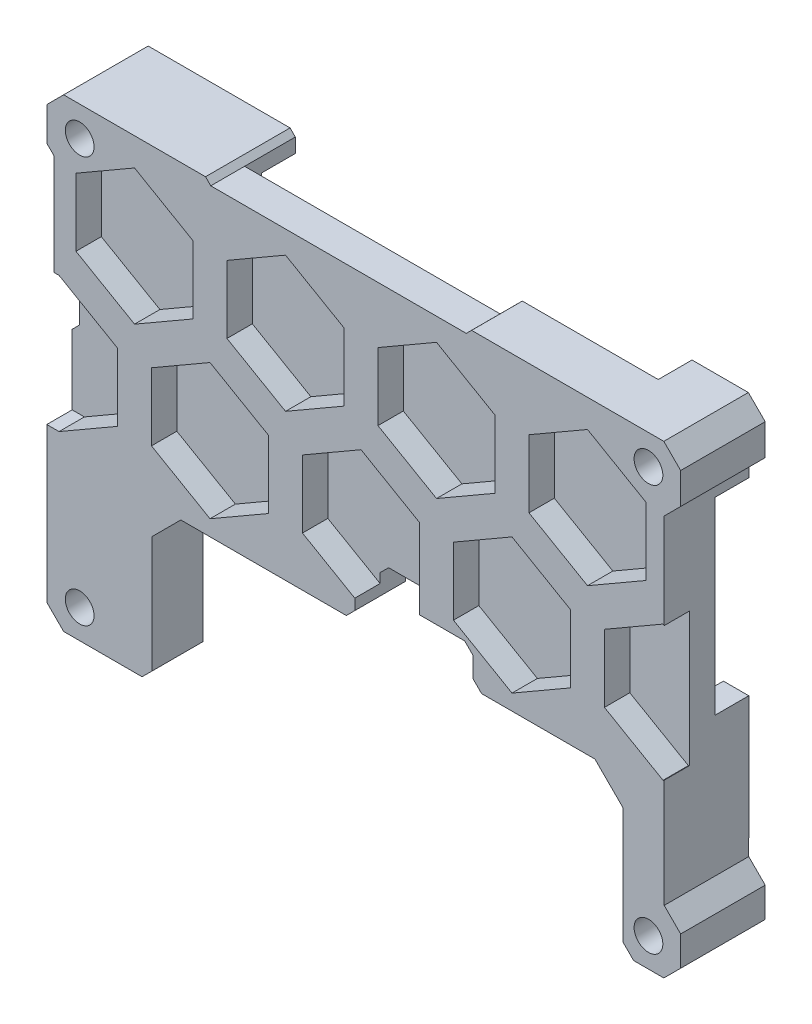
from build123d import *

# Parameters (mm, degrees)
SKETCH_1_W           = 85
SKETCH_1_H           = 65
EXTRUDE_1_DEPTH      = 10
CUT_EXTRUDE_1_REACH  = 109.471
SKETCH_2_R           = 1.7
CUT_EXTRUDE_2_REACH  = 109.471
SKETCH_3_W           = 85
SKETCH_3_H           = 65
CUT_EXTRUDE_4_REACH  = 102.464
CUT_EXTRUDE_7_DEPTH  = 6
CUT_EXTRUDE_8_DEPTH  = 6
CUT_EXTRUDE_11_DEPTH = 4
SKETCH_8_W           = 8
SKETCH_8_H           = 5
CUT_EXTRUDE_12_DEPTH = 1
SKETCH_10_W          = 5.4
SKETCH_10_H          = 6
SKETCH_10_W_2        = 4
EXTRUDE_2_DEPTH      = 3.04
SKETCH_11_W          = 4.2
SKETCH_11_H          = 5
EXTRUDE_3_DEPTH      = 2.300115
SKETCH_12_W          = 12
SKETCH_12_H          = 6
EXTRUDE_4_DEPTH      = 2.89
SKETCH_13_W          = 6.499986347
SKETCH_13_H          = 5.115524378
EXTRUDE_5_DEPTH      = 3.6
SKETCH_14_W          = 6
SKETCH_14_H          = 7
EXTRUDE_6_DEPTH      = 2.890002
SKETCH_15_W          = 14
SKETCH_15_H          = 4.4
CUT_EXTRUDE_13_DEPTH = 6
CHAMFER_1_SIZE       = 1
CHAMFER_2_SIZE       = 0.6
CHAMFER_3_SIZE       = 0.6
CHAMFER_4_SIZE       = 0.6
CHAMFER_5_SIZE       = 0.6
CHAMFER_6_SIZE       = 0.6
CUT_EXTRUDE_15_DEPTH = 3
CUT_EXTRUDE_16_DEPTH = 3


with BuildPart() as part:
    # 草图1 → 凸台-拉伸1 (new body)
    with BuildSketch(Plane.XY):
        with Locations((42.5, 32.5)):
            Rectangle(SKETCH_1_W, SKETCH_1_H)
    extrude(amount=EXTRUDE_1_DEPTH)

    # 草图2 → 切除-拉伸1 (cut, up to next)
    with BuildSketch(Plane(origin=(0, 0, 0), x_dir=(-1, 0, 0), z_dir=(0, 0, -1)), mode=Mode.PRIVATE) as cut_extrude_1_sk1:
        with Locations((-76.166921514, 56.442524765)):
            Circle(SKETCH_2_R)
    cut_extrude_1_tool1 = extrude(cut_extrude_1_sk1.sketch, amount=-CUT_EXTRUDE_1_REACH, mode=Mode.PRIVATE) & part.part
    # 草图2 → 切除-拉伸1 (cut, up to next)
    with BuildSketch(Plane(origin=(0, 0, 0), x_dir=(-1, 0, 0), z_dir=(0, 0, -1)), mode=Mode.PRIVATE) as cut_extrude_1_sk2:
        with Locations((-8.888803658, 56.442524765)):
            Circle(SKETCH_2_R)
    cut_extrude_1_tool2 = extrude(cut_extrude_1_sk2.sketch, amount=-CUT_EXTRUDE_1_REACH, mode=Mode.PRIVATE) & part.part
    # 草图2 → 切除-拉伸1 (cut, up to next)
    with BuildSketch(Plane(origin=(0, 0, 0), x_dir=(-1, 0, 0), z_dir=(0, 0, -1)), mode=Mode.PRIVATE) as cut_extrude_1_sk3:
        with Locations((-76.166921514, 8.41508509)):
            Circle(SKETCH_2_R)
    cut_extrude_1_tool3 = extrude(cut_extrude_1_sk3.sketch, amount=-CUT_EXTRUDE_1_REACH, mode=Mode.PRIVATE) & part.part
    # 草图2 → 切除-拉伸1 (cut, up to next)
    with BuildSketch(Plane(origin=(0, 0, 0), x_dir=(-1, 0, 0), z_dir=(0, 0, -1)), mode=Mode.PRIVATE) as cut_extrude_1_sk4:
        with Locations((-8.888803658, 8.41508509)):
            Circle(SKETCH_2_R)
    cut_extrude_1_tool4 = extrude(cut_extrude_1_sk4.sketch, amount=-CUT_EXTRUDE_1_REACH, mode=Mode.PRIVATE) & part.part
    add(cut_extrude_1_tool1.solids().sort_by_distance((76.166922, 56.442525, 0))[0], mode=Mode.SUBTRACT)
    add(cut_extrude_1_tool2.solids().sort_by_distance((8.888804, 56.442525, 0))[0], mode=Mode.SUBTRACT)
    add(cut_extrude_1_tool3.solids().sort_by_distance((76.166922, 8.415085, 0))[0], mode=Mode.SUBTRACT)
    add(cut_extrude_1_tool4.solids().sort_by_distance((8.888804, 8.415085, 0))[0], mode=Mode.SUBTRACT)

    # 草图3 → 切除-拉伸2 (cut, up to next)
    with BuildSketch(Plane(origin=(0, 0, 0), x_dir=(-1, 0, 0), z_dir=(0, 0, -1)), mode=Mode.PRIVATE) as cut_extrude_2_sk1:
        with Locations((-42.5, 32.5)):
            Rectangle(SKETCH_3_W, SKETCH_3_H)
        Polygon((-5, 33.462892894), (-5.871324699, 34.334217592), (-5.87504445, 53.137061214), (-5, 54.017366187), (-5, 57.982143592), (-6.992565577, 59.974709169), (-23.773560915, 59.974709169), (-24.394872914, 59.353397171), (-54.61482093, 59.349677419), (-55.245113202, 59.974709169), (-77.982184232, 59.974709169), (-79.974749809, 57.982143592), (-79.97474981, 54.295829484), (-78.032030648, 52.353110322), (-78.028310897, 12.45999492), (-79.97474981, 10.508295484), (-79.97474981, 6.992565577), (-77.982184232, 5), (-74.414239441, 5), (-73.152434681, 6.26180476), (-60.043505207, 6.265524511), (-58.772720173, 5), (-32.926479725, 5), (-31.743585303, 6.182894422), (-17.461559563, 6.186614173), (-16.269684867, 5), (-6.992565577, 5), (-5, 6.992565577), align=None, mode=Mode.SUBTRACT)
    cut_extrude_2_tool1 = extrude(cut_extrude_2_sk1.sketch, amount=-CUT_EXTRUDE_2_REACH, mode=Mode.PRIVATE) & part.part
    add(cut_extrude_2_tool1.solids().sort_by_distance((42.5, 63.929953, 0))[0], mode=Mode.SUBTRACT)

    # 草图4 → 切除-拉伸4 (cut, up to next)
    with BuildSketch(Plane(origin=(0, 0, 0), x_dir=(-1, 0, 0), z_dir=(0, 0, -1)), mode=Mode.PRIVATE) as cut_extrude_4_sk1:
        Polygon((-73.152434681, 6.26180476), (-73.152434681, 20.032317315), (-69.831576581, 23.353175415), (-46.787984184, 23.353175415), (-20.851296271, 23.353175415), (-17.461559563, 19.963438707), (-17.461559563, 6.186614173), (-17.461559563, 0.193960815), (-73.152434681, 0.193960815), align=None)
    cut_extrude_4_tool1 = extrude(cut_extrude_4_sk1.sketch, amount=-CUT_EXTRUDE_4_REACH, mode=Mode.PRIVATE) & part.part
    add(cut_extrude_4_tool1.solids().sort_by_distance((45.311727, 11.681443, 0))[0], mode=Mode.SUBTRACT)

    # 草图5 → 切除-拉伸7 (cut)
    with BuildSketch(Plane(origin=(0, 0, 0), x_dir=(-1, 0, 0), z_dir=(0, 0, -1))):
        Polygon((-24.394872914, 59.353397171), (-24.394872914, 53.906418167), (-25.526104495, 52.774908066), (-53.482640788, 52.774908066), (-54.614150889, 53.906139647), (-54.61482093, 59.349677419), align=None)
    extrude(amount=-CUT_EXTRUDE_7_DEPTH, mode=Mode.SUBTRACT)

    # 草图6 → 切除-拉伸8 (cut)
    with BuildSketch(Plane(origin=(0, 0, 0), x_dir=(-1, 0, 0), z_dir=(0, 0, -1))):
        Polygon((-5.871324699, 34.334217592), (-11.136213102, 34.334217592), (-11.687697798, 35.836171197), (-11.687697798, 43.836171197), (-10.273484235, 45.250384759), (-5.873484235, 45.250384759), align=None)
    extrude(amount=-CUT_EXTRUDE_8_DEPTH, mode=Mode.SUBTRACT)

    # 草图7 → 切除-拉伸11 (cut)
    with BuildSketch(Plane(origin=(0, 0, 0), x_dir=(-1, 0, 0), z_dir=(0, 0, -1))):
        Polygon((-74.432117646, 51.26230094), (-76.432117646, 51.26230094), (-78.031928938, 51.26230094), (-78.029847328, 28.93771831), (-75.029847328, 28.93771831), (-75.029847328, 13.93771831), (-73.152434681, 12.060305663), (-73.152434681, 20.032317315), (-69.831576581, 23.353175415), (-20.851296271, 23.353175415), (-17.461559563, 19.963438707), (-17.461559563, 6.186614173), (-16.269684867, 5), (-12.014024847, 5), (-12.014024847, 10.599811284), (-10.599811284, 12.014024847), (-6.599811284, 12.014024847), (-5, 12.014024847), (-5, 33.462892894), (-5.871324699, 34.334217592), (-11.136213102, 34.334217592), (-11.687697798, 35.836171197), (-11.687697798, 43.836171197), (-10.273484235, 45.250384759), (-5.873484235, 45.250384759), (-5.87504445, 53.137061214), (-9.87504445, 53.137061214), (-12.071959353, 55.333976117), (-12.071959353, 58.333976117), (-23.061659554, 58.333976117), (-23.732127818, 57.663342778), (-24.394872914, 57.663261201), (-24.394872914, 53.906418167), (-25.526104495, 52.774908066), (-53.482640788, 52.774908066), (-54.614150889, 53.906139647), (-54.61482093, 59.349677419), (-55.245113202, 59.974709169), (-71.319520701, 59.974709169), (-71.319520701, 58.374897885), (-71.319520701, 54.374897885), align=None)
    extrude(amount=-CUT_EXTRUDE_11_DEPTH, mode=Mode.SUBTRACT)

    # 草图8 → 切除-拉伸12 (cut)
    with BuildSketch(Plane(origin=(0, 0, 4), x_dir=(-1, 0, 0), z_dir=(0, 0, -1))):
        with Locations((-69.348077333, 43.45871309)):
            Rectangle(SKETCH_8_W, SKETCH_8_H)
    extrude(amount=-CUT_EXTRUDE_12_DEPTH, mode=Mode.SUBTRACT)

    # 草图10 → 凸台-拉伸2 (add)
    with BuildSketch(Plane(origin=(0, 0, 4), x_dir=(-1, 0, 0), z_dir=(0, 0, -1))):
        with Locations((-44.246532103, 31.889800214)):
            Rectangle(SKETCH_10_W, SKETCH_10_H)
        with Locations((-39.546532103, 31.889800214)):
            Rectangle(SKETCH_10_W_2, SKETCH_10_H)
        with Locations((-34.846532103, 31.889800214)):
            Rectangle(SKETCH_10_W, SKETCH_10_H)
    extrude(amount=EXTRUDE_2_DEPTH)

    # 草图11 → 凸台-拉伸3 (add)
    with BuildSketch(Plane(origin=(0, 0, 4), x_dir=(-1, 0, 0), z_dir=(0, 0, -1))):
        with Locations((-38.731800654, 41.192864876)):
            Rectangle(SKETCH_11_W, SKETCH_11_H)
    extrude(amount=EXTRUDE_3_DEPTH)

    # 草图12 → 凸台-拉伸4 (add)
    with BuildSketch(Plane(origin=(0, 0, 4), x_dir=(-1, 0, 0), z_dir=(0, 0, -1))):
        with Locations((-24.610605003, 27.685920752)):
            Rectangle(SKETCH_12_W, SKETCH_12_H)
    extrude(amount=EXTRUDE_4_DEPTH)

    # 草图13 → 凸台-拉伸5 (add)
    with BuildSketch(Plane(origin=(0, 0, 4), x_dir=(-1, 0, 0), z_dir=(0, 0, -1))):
        with Locations((-61.319842519, 38.061085021)):
            Rectangle(SKETCH_13_W, SKETCH_13_H)
    extrude(amount=EXTRUDE_5_DEPTH)

    # 草图14 → 凸台-拉伸6 (add)
    with BuildSketch(Plane(origin=(0, 0, 4), x_dir=(-1, 0, 0), z_dir=(0, 0, -1))):
        with Locations((-62.740849727, 27.111901224)):
            Rectangle(SKETCH_14_W, SKETCH_14_H)
    extrude(amount=EXTRUDE_6_DEPTH)

    # 草图15 → 切除-拉伸13 (cut)
    with BuildSketch(Plane.XY.offset(10)):
        with Locations((48.428848604, 25.553175415)):
            Rectangle(SKETCH_15_W, SKETCH_15_H)
    extrude(amount=-CUT_EXTRUDE_13_DEPTH, mode=Mode.SUBTRACT)

    # 倒角1
    chamfer_1_edges = [part.edges().sort_by_distance(p)[0] for p in [
        (55.428848604, 23.353175415, 7),
        (55.428848604, 27.753175415, 7),
        (41.428848604, 27.753175415, 7),
        (41.428848604, 23.353175415, 7),
    ]]
    chamfer(chamfer_1_edges, length=CHAMFER_1_SIZE)

    # 倒角2
    chamfer_2_edges = [part.edges().sort_by_distance(p)[0] for p in [
        (64.569835693, 38.061085021, 4),
        (61.31984252, 35.503322832, 4),
        (58.069849346, 38.061085021, 4),
        (61.31984252, 40.61884721, 4),
    ]]
    chamfer(chamfer_2_edges, length=CHAMFER_2_SIZE)

    # 倒角3
    chamfer_3_edges = [part.edges().sort_by_distance(p)[0] for p in [
        (39.546532103, 28.889800214, 4),
        (46.946532103, 31.889800214, 4),
        (39.546532103, 34.889800214, 4),
        (32.146532103, 31.889800214, 4),
    ]]
    chamfer(chamfer_3_edges, length=CHAMFER_3_SIZE)

    # 倒角4
    chamfer_4_edges = [part.edges().sort_by_distance(p)[0] for p in [
        (30.610605003, 27.685920752, 4),
        (24.610605003, 24.685920752, 4),
        (18.610605003, 27.685920752, 4),
        (24.610605003, 30.685920752, 4),
    ]]
    chamfer(chamfer_4_edges, length=CHAMFER_4_SIZE)

    # 倒角5
    chamfer_5_edges = [part.edges().sort_by_distance(p)[0] for p in [
        (40.831800654, 41.192864876, 4),
        (38.731800654, 38.692864876, 4),
        (36.631800654, 41.192864876, 4),
        (38.731800654, 43.692864876, 4),
    ]]
    chamfer(chamfer_5_edges, length=CHAMFER_5_SIZE)

    # 倒角6
    chamfer_6_edges = [part.edges().sort_by_distance(p)[0] for p in [
        (65.740849727, 27.111901224, 4),
        (59.740849727, 27.111901224, 4),
        (62.740849727, 30.611901224, 4),
    ]]
    chamfer(chamfer_6_edges, length=CHAMFER_6_SIZE)

    # 草图17 → 切除-拉伸15 (cut)
    with BuildSketch(Plane.XY.offset(10)):
        Polygon((40.166139484, 44.674395647), (40.166139484, 52.674395647), (33.237936254, 56.674395647), (26.309733024, 52.674395647), (26.309733024, 44.674395647), (33.237936254, 40.674395647), align=None)
        Polygon((22.306139484, 44.674395647), (22.306139484, 52.674395647), (15.377936254, 56.674395647), (8.449733024, 52.674395647), (8.449733024, 44.674395647), (15.377936254, 40.674395647), align=None)
        Polygon((58.026139484, 44.674395647), (58.026139484, 52.674395647), (51.097936254, 56.674395647), (44.169733024, 52.674395647), (44.169733024, 44.674395647), (51.097936254, 40.674395647), align=None)
        Polygon((75.886139484, 44.674395647), (75.886139484, 52.674395647), (68.957936254, 56.674395647), (62.029733024, 52.674395647), (62.029733024, 44.674395647), (68.957936254, 40.674395647), align=None)
        Polygon((93.746139484, 44.674395647), (93.746139484, 52.674395647), (86.817936254, 56.674395647), (79.889733024, 52.674395647), (79.889733024, 44.674395647), (86.817936254, 40.674395647), align=None)
        Polygon((31.236139484, 29.207181935), (31.236139484, 37.207181935), (24.307936254, 41.207181935), (17.379733024, 37.207181935), (17.379733024, 29.207181935), (24.307936254, 25.207181935), align=None)
        Polygon((49.096139484, 29.207181935), (49.096139484, 37.207181935), (42.167936254, 41.207181935), (35.239733024, 37.207181935), (35.239733024, 29.207181935), (42.167936254, 25.207181935), align=None)
        Polygon((66.956139484, 29.207181935), (66.956139484, 37.207181935), (60.027936254, 41.207181935), (53.099733024, 37.207181935), (53.099733024, 29.207181935), (60.027936254, 25.207181935), align=None)
        Polygon((84.816139484, 29.207181935), (84.816139484, 37.207181935), (77.887936254, 41.207181935), (70.959733024, 37.207181935), (70.959733024, 29.207181935), (77.887936254, 25.207181935), align=None)
        Polygon((13.376139484, 29.207181935), (13.376139484, 37.207181935), (6.447936254, 41.207181935), (-0.480266976, 37.207181935), (-0.480266976, 29.207181935), (6.447936254, 25.207181935), align=None)
    extrude(amount=-CUT_EXTRUDE_15_DEPTH, mode=Mode.SUBTRACT)

    # 草图18 → 切除-拉伸16 (cut)
    with BuildSketch(Plane.XY.offset(10)):
        Polygon((6.447936254, 41.207181935), (5.872684372, 41.207181935), (5.872618661, 40.875022168), align=None)
        Polygon((6.447936254, 25.207181935), (5, 25.207181935), (5, 26.043148321), align=None)
        Polygon((49.096139484, 29.207181935), (49.096139484, 27.753175415), (46.577726316, 27.753175415), align=None)
    extrude(amount=-CUT_EXTRUDE_16_DEPTH, mode=Mode.SUBTRACT)


solid = part.part
